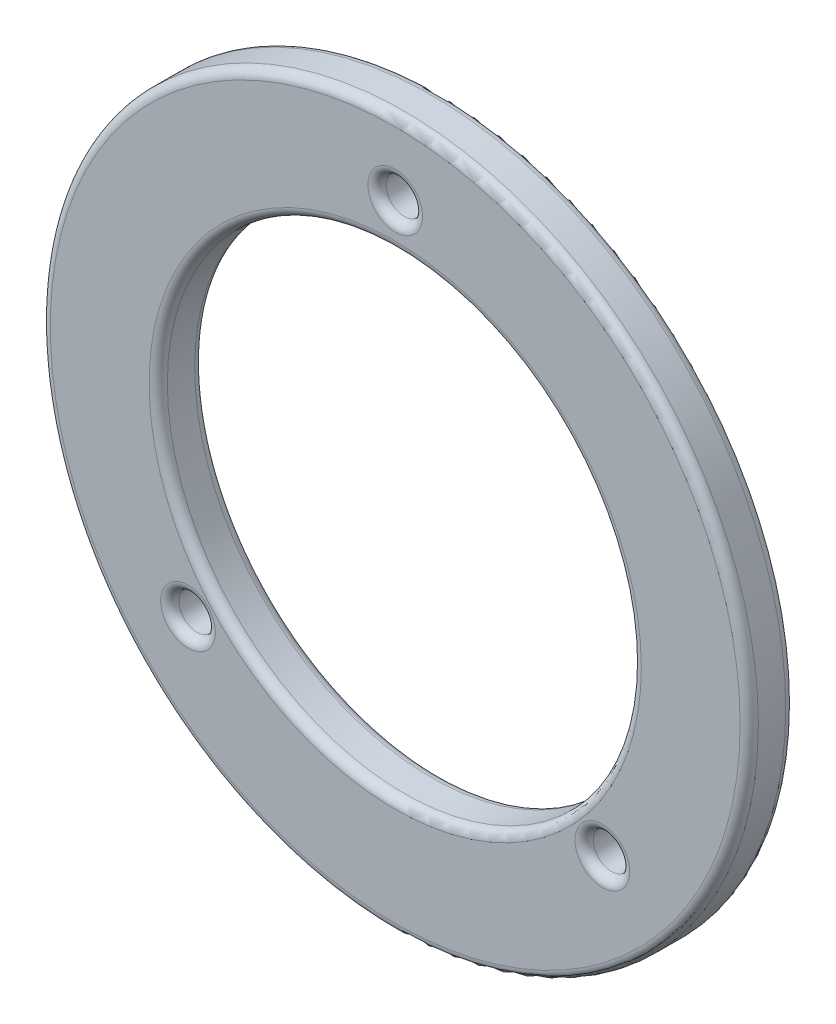
from build123d import *

# Parameters (mm, degrees)
SKETCH1_R           = 49.3268
SKETCH1_R_2         = 2.54
SKETCH1_R_3         = 33.02
BOSS_EXTRUDE1_DEPTH = 3.175
FILLET1_R           = 1.27


with BuildPart() as part:
    # Sketch1 → Boss-Extrude1 (new, symmetric)
    with BuildSketch(Plane.XY):
        Circle(SKETCH1_R)
        with Locations((0, 39.1668)):
            Circle(SKETCH1_R_2, mode=Mode.SUBTRACT)
        Circle(SKETCH1_R_3, mode=Mode.SUBTRACT)
        with Locations((28.8671, -25.45586183)):
            Circle(SKETCH1_R_2, mode=Mode.SUBTRACT)
        with Locations((-28.8671, -25.45586183)):
            Circle(SKETCH1_R_2, mode=Mode.SUBTRACT)
    extrude(amount=BOSS_EXTRUDE1_DEPTH, both=True)

    # Fillet1
    fillet1_edges = [part.edges().sort_by_distance(p)[0] for p in [
        (-31.4071, -25.45586183, 3.175),
        (26.3271, -25.45586183, 3.175),
        (-33.02, 0, 3.175),
        (-2.54, 39.1668, 3.175),
        (-49.3268, 0, 3.175),
        (-49.3268, 0, -3.175),
        (-2.54, 39.1668, -3.175),
        (-33.02, 0, -3.175),
        (26.3271, -25.45586183, -3.175),
        (-31.4071, -25.45586183, -3.175),
    ]]
    fillet(fillet1_edges, radius=FILLET1_R)


solid = part.part
